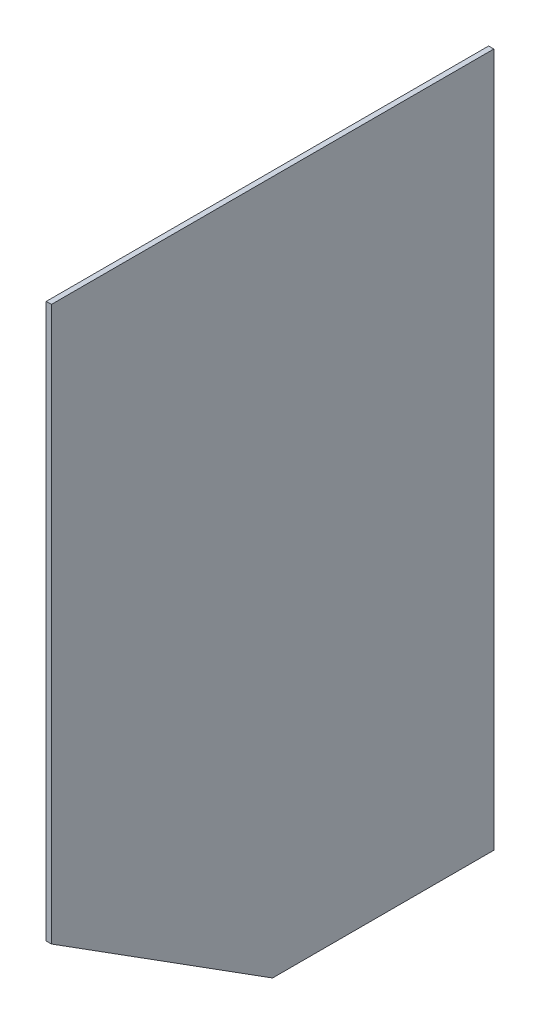
from build123d import *

# Parameters (mm, degrees)
SKETCH1_W           = 3
SKETCH1_H           = 400
BOSS_EXTRUDE1_DEPTH = 255
CUT_EXTRUDE1_DEPTH  = 371.88080499


with BuildPart() as part:
    # Sketch1 → Boss-Extrude1 (new body)
    with BuildSketch(Plane.XY):
        with Locations((-139.199495781, 69.292724577)):
            Rectangle(SKETCH1_W, SKETCH1_H)
    extrude(amount=-BOSS_EXTRUDE1_DEPTH)

    # Sketch2 → Cut-Extrude1 (cut, through all)
    with BuildSketch(Plane.ZY.offset(140.699495781)):
        Polygon((0, -130.707275423), (0, -50), (-127.5, -130.707275423), align=None)
    extrude(amount=-CUT_EXTRUDE1_DEPTH, mode=Mode.SUBTRACT)


solid = part.part
